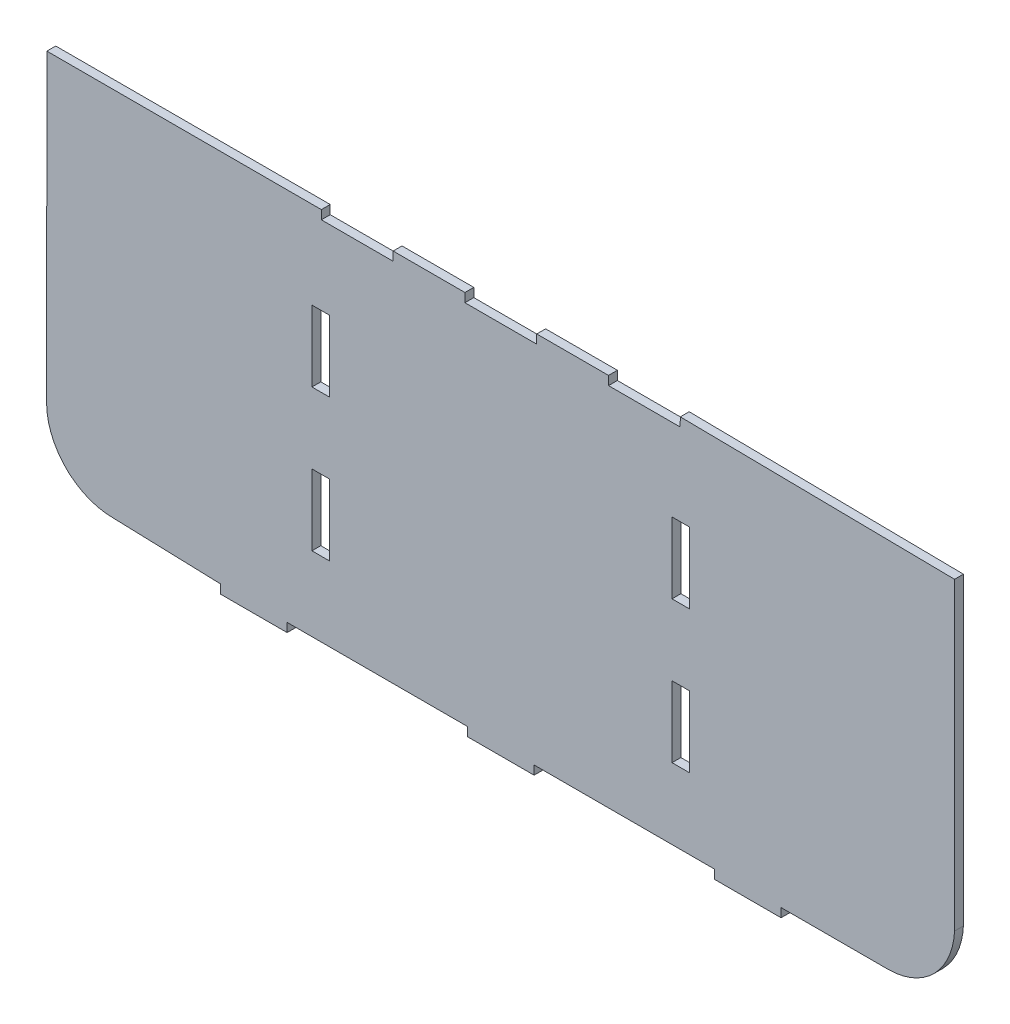
from build123d import *

# Parameters (mm, degrees)
SKETCH1_W           = 20.32
SKETCH1_H           = 81.316938585
SKETCH1_H_2         = 81.316938584
BOSS_EXTRUDE1_DEPTH = 10.16


with BuildPart() as part:
    # Sketch1 → Boss-Extrude1 (new body)
    # profile 1 of 2: a face of its own
    with BuildSketch(Plane.XY):
        with BuildLine():
            ThreePointArc((-520.699999986, 86.36), (-498.381536717, 32.478463279), (-444.5, 10.16))
            Line((-444.5, 10.16), (-321.2, 6.224098454))
            Line((-321.2, 6.224098454), (-321.2, -3.935901546))
            Line((-321.2, -3.935901546), (-245, -3.935901546))
            Line((-245, -3.935901546), (-245, 6.224098454))
            Line((-245, 6.224098454), (-38.1, 6.224098454))
            Line((-38.1, 6.224098454), (-38.1, -3.935901546))
            Line((-38.1, -3.935901546), (38.1, -3.935901546))
            Line((38.1, -3.935901546), (38.1, 6.224098454))
            Line((38.1, 6.224098454), (245, 6.224098454))
            Line((245, 6.224098454), (245, -3.935901546))
            Line((245, -3.935901546), (321.2, -3.935901546))
            Line((321.2, -3.935901546), (321.2, 6.224098454))
            Line((321.2, 6.224098454), (444.500003861, 6.224098454))
            add(Edge.make_bspline(
                [(444.500003861, 6.224098454), (516.375223264, 6.870661069), (520.046520409, 82.264098454)],
                knots=[3.150157412, 3.150157412, 3.150157412, 4.661289858, 4.661289858, 4.661289858], degree=2, weights=[1, 0.7278834, 1]))
            Line((520.046520409, 82.264098454), (520.070316171, 431.514078957))
            Line((520.070316171, 431.514078957), (205.706405146, 435.61))
            Line((205.706405146, 435.61), (205.558012439, 425.45))
            Line((205.558012439, 425.45), (123.444, 425.45))
            Line((123.444, 425.45), (123.444, 435.61))
            Line((123.444, 435.61), (41.148, 435.61))
            Line((41.148, 435.61), (41.148, 425.45))
            Line((41.148, 425.45), (-41.148, 425.45))
            Line((-41.148, 425.45), (-41.148, 435.61))
            Line((-41.148, 435.61), (-123.444, 435.61))
            Line((-123.444, 435.61), (-123.444, 425.45))
            Line((-123.444, 425.45), (-205.739999986, 425.45))
            Line((-205.739999986, 425.45), (-205.739999986, 388.35))
            Line((-205.739999986, 388.35), (-230.359692704, 388.35))
            Line((-230.359692704, 388.35), (-230.359692704, 435.61))
            Line((-230.359692704, 435.61), (-520.3601107, 435.61))
            Line((-520.3601107, 435.61), (-520.699999986, 86.36))
        make_face()
        with Locations((-206.375268781, 132.135407878)):
            Rectangle(SKETCH1_W, SKETCH1_H, mode=Mode.SUBTRACT)
        with Locations((206.375268781, 128.199506331)):
            Rectangle(SKETCH1_W, SKETCH1_H_2, mode=Mode.SUBTRACT)
        with Locations((-206.375268781, 294.769285048)):
            Rectangle(SKETCH1_W, SKETCH1_H, mode=Mode.SUBTRACT)
        with Locations((206.375268781, 290.833383501)):
            Rectangle(SKETCH1_W, SKETCH1_H, mode=Mode.SUBTRACT)
    # profile 2 of 2: a face of its own
    with BuildSketch(Plane.XY):
        Polygon((-205.739999986, 435.61), (-230.359692704, 435.61), (-230.359692704, 388.35), (-205.739999986, 388.35), (-205.739999986, 425.45), align=None)
    extrude(amount=BOSS_EXTRUDE1_DEPTH)


solid = part.part
